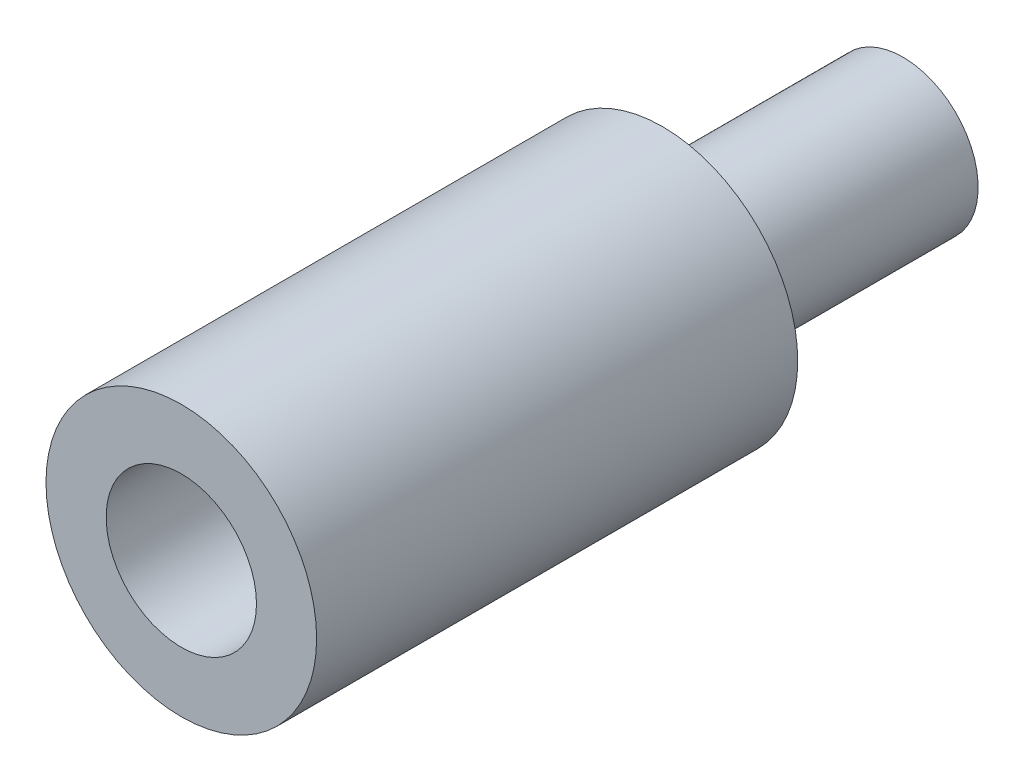
from build123d import *

# Parameters (mm, degrees)
SKETCH_1_R          = 2.25
EXTRUDE_1_DEPTH     = 8
SKETCH_2_R          = 1.25
CUT_EXTRUDE_1_DEPTH = 15
SKETCH_3_R          = 1.25
EXTRUDE_2_DEPTH     = 4


with BuildPart() as part:
    # 草图1 → 凸台-拉伸1 (new body)
    with BuildSketch(Plane.XY):
        Circle(SKETCH_1_R)
    extrude(amount=EXTRUDE_1_DEPTH)

    # 草图2 → 切除-拉伸1 (cut)
    with BuildSketch(Plane.XY.offset(8)):
        Circle(SKETCH_2_R)
    extrude(amount=-CUT_EXTRUDE_1_DEPTH, mode=Mode.SUBTRACT)


with BuildPart() as body_2:
    # 草图3 → 凸台-拉伸2 (new body)
    with BuildSketch(Plane(origin=(0, 0, 0), x_dir=(-1, 0, 0), z_dir=(0, 0, -1))):
        Circle(SKETCH_3_R)
    extrude(amount=EXTRUDE_2_DEPTH)


solid = Compound([part.part, body_2.part])
